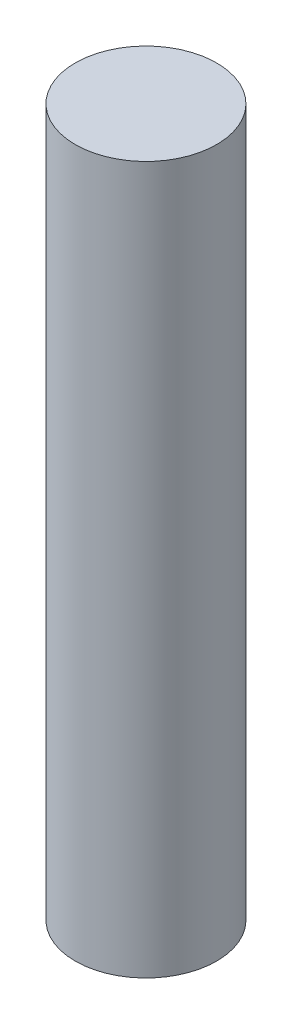
from build123d import *

# Parameters (mm, degrees)
SKETCH1_R           = 20
BOSS_EXTRUDE1_DEPTH = 200


with BuildPart() as part:
    # Sketch1 → Boss-Extrude1 (new body)
    with BuildSketch(Plane(origin=(0, 0, 0), x_dir=(1, 0, 0), z_dir=(0, 1, 0))):
        with Locations(Location((0, 0, 0), (0, 0, 270))):
            Circle(SKETCH1_R)
    extrude(amount=BOSS_EXTRUDE1_DEPTH)


solid = part.part
